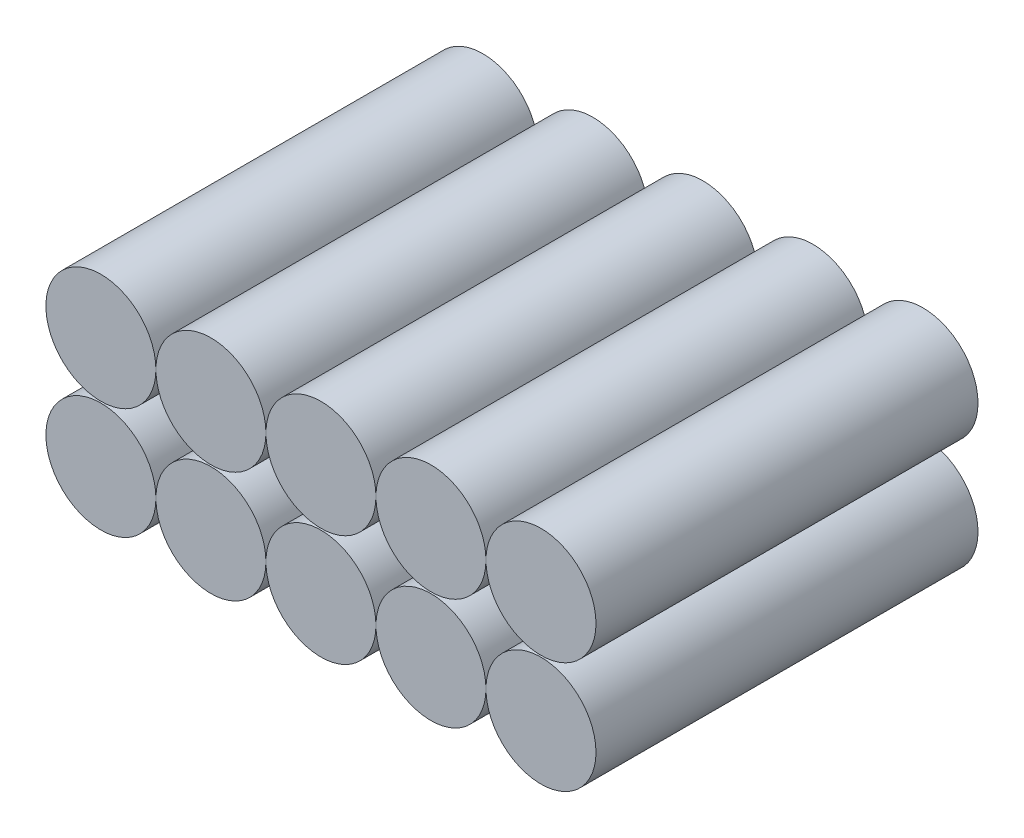
from build123d import *

# Parameters (mm, degrees)
SKETCH1_R              = 7.2
BOSS_EXTRUDE1_DEPTH    = 50
BOSS_EXTRUDE1_2_DEPTH  = 50
BOSS_EXTRUDE1_3_DEPTH  = 50
BOSS_EXTRUDE1_4_DEPTH  = 50
BOSS_EXTRUDE1_5_DEPTH  = 50
BOSS_EXTRUDE1_6_DEPTH  = 50
BOSS_EXTRUDE1_7_DEPTH  = 50
BOSS_EXTRUDE1_8_DEPTH  = 50
BOSS_EXTRUDE1_9_DEPTH  = 50
BOSS_EXTRUDE1_10_DEPTH = 50


with BuildPart() as part:
    # Sketch1 → Boss-Extrude1 (new body)
    with BuildSketch(Plane.XY):
        Circle(SKETCH1_R)
    extrude(amount=-BOSS_EXTRUDE1_DEPTH)


with BuildPart() as body_2:
    # Sketch1 → Boss-Extrude1 2 (new body)
    with BuildSketch(Plane.XY):
        with Locations((28.8, 0)):
            Circle(SKETCH1_R)
    extrude(amount=-BOSS_EXTRUDE1_2_DEPTH)


with BuildPart() as body_3:
    # Sketch1 → Boss-Extrude1 3 (new body)
    with BuildSketch(Plane.XY):
        with Locations((14.4, 0)):
            Circle(SKETCH1_R)
    extrude(amount=-BOSS_EXTRUDE1_3_DEPTH)


with BuildPart() as body_4:
    # Sketch1 → Boss-Extrude1 4 (new body)
    with BuildSketch(Plane.XY):
        with Locations((43.2, 0)):
            Circle(SKETCH1_R)
    extrude(amount=-BOSS_EXTRUDE1_4_DEPTH)


with BuildPart() as body_5:
    # Sketch1 → Boss-Extrude1 5 (new body)
    with BuildSketch(Plane.XY):
        with Locations((57.6, 0)):
            Circle(SKETCH1_R)
    extrude(amount=-BOSS_EXTRUDE1_5_DEPTH)


with BuildPart() as body_6:
    # Sketch1 → Boss-Extrude1 6 (new body)
    with BuildSketch(Plane.XY):
        with Locations((0, 14.6)):
            Circle(SKETCH1_R)
    extrude(amount=-BOSS_EXTRUDE1_6_DEPTH)


with BuildPart() as body_7:
    # Sketch1 → Boss-Extrude1 7 (new body)
    with BuildSketch(Plane.XY):
        with Locations((14.4, 14.6)):
            Circle(SKETCH1_R)
    extrude(amount=-BOSS_EXTRUDE1_7_DEPTH)


with BuildPart() as body_8:
    # Sketch1 → Boss-Extrude1 8 (new body)
    with BuildSketch(Plane.XY):
        with Locations((28.8, 14.6)):
            Circle(SKETCH1_R)
    extrude(amount=-BOSS_EXTRUDE1_8_DEPTH)


with BuildPart() as body_9:
    # Sketch1 → Boss-Extrude1 9 (new body)
    with BuildSketch(Plane.XY):
        with Locations((43.2, 14.6)):
            Circle(SKETCH1_R)
    extrude(amount=-BOSS_EXTRUDE1_9_DEPTH)


with BuildPart() as body_10:
    # Sketch1 → Boss-Extrude1 10 (new body)
    with BuildSketch(Plane.XY):
        with Locations((57.6, 14.6)):
            Circle(SKETCH1_R)
    extrude(amount=-BOSS_EXTRUDE1_10_DEPTH)


solid = Compound([part.part, body_2.part, body_3.part, body_4.part, body_5.part, body_6.part, body_7.part, body_8.part, body_9.part, body_10.part])
